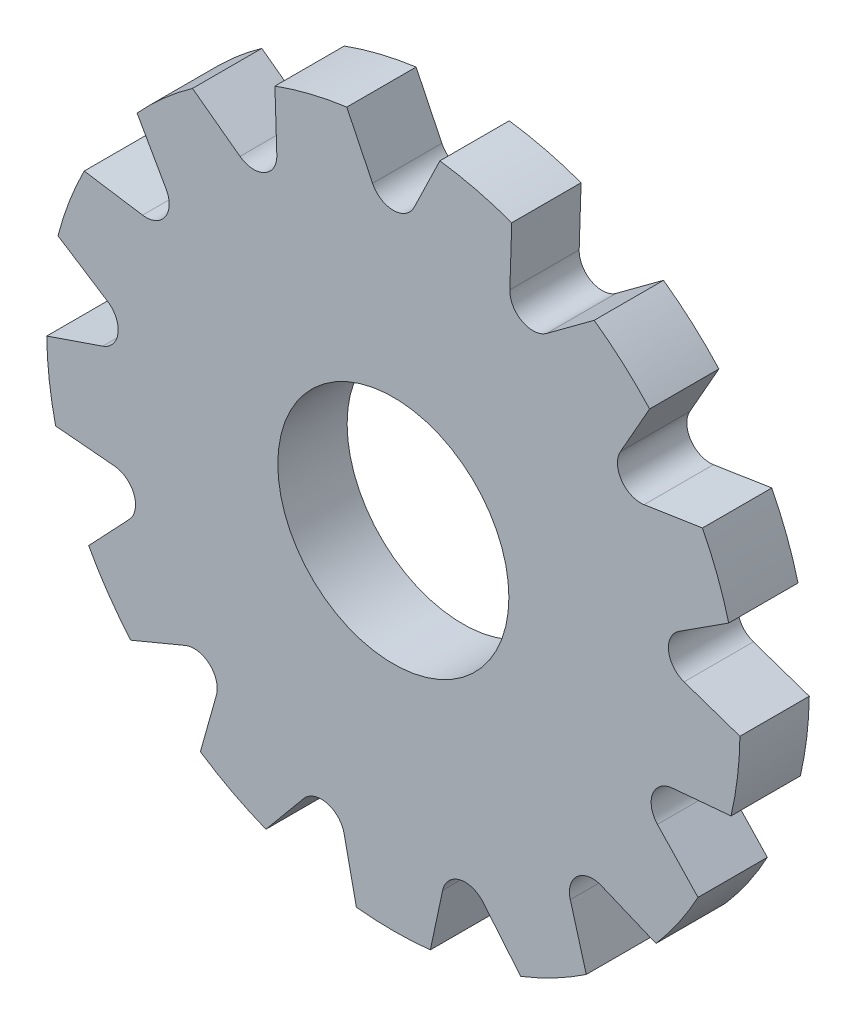
from build123d import *

# Parameters (mm, degrees)
SKETCH1_R           = 30
SKETCH1_R_2         = 10
BOSS_EXTRUDE1_DEPTH = 6
CUT_EXTRUDE1_START  = -6
CUT_EXTRUDE1_DEPTH  = 6
CIRPATTERN1_COUNT   = 13


with BuildPart() as part:
    # Sketch1 → Boss-Extrude1 (new body)
    with BuildSketch(Plane.XY):
        Circle(SKETCH1_R)
        Circle(SKETCH1_R_2, mode=Mode.SUBTRACT)
    extrude(amount=BOSS_EXTRUDE1_DEPTH)

    # Sketch2 → Cut-Extrude1 (cut)
    with BuildSketch(Plane.XY.offset(6).offset(CUT_EXTRUDE1_START)):
        with BuildLine():
            Line((-4.028701623, 29.728262028), (-1.799877236, 25.12796678))
            ThreePointArc((-1.799877236, 25.12796678), (0, 24), (1.799877236, 25.12796678))
            Line((1.799877236, 25.12796678), (4.028701623, 29.728262028))
            ThreePointArc((4.028701623, 29.728262028), (0, 30), (-4.028701623, 29.728262028))
        make_face()
    cut_extrude1 = extrude(amount=CUT_EXTRUDE1_DEPTH, mode=Mode.SUBTRACT)

    # CirPattern1: Cut-Extrude1 ×13 about axis
    cirpattern1_axis = Axis((0, 0, 0), (0, 0, 1))
    for i in range(1, CIRPATTERN1_COUNT):
        add(cut_extrude1.rotate(cirpattern1_axis, i * 360 / CIRPATTERN1_COUNT), mode=Mode.SUBTRACT)


solid = part.part
